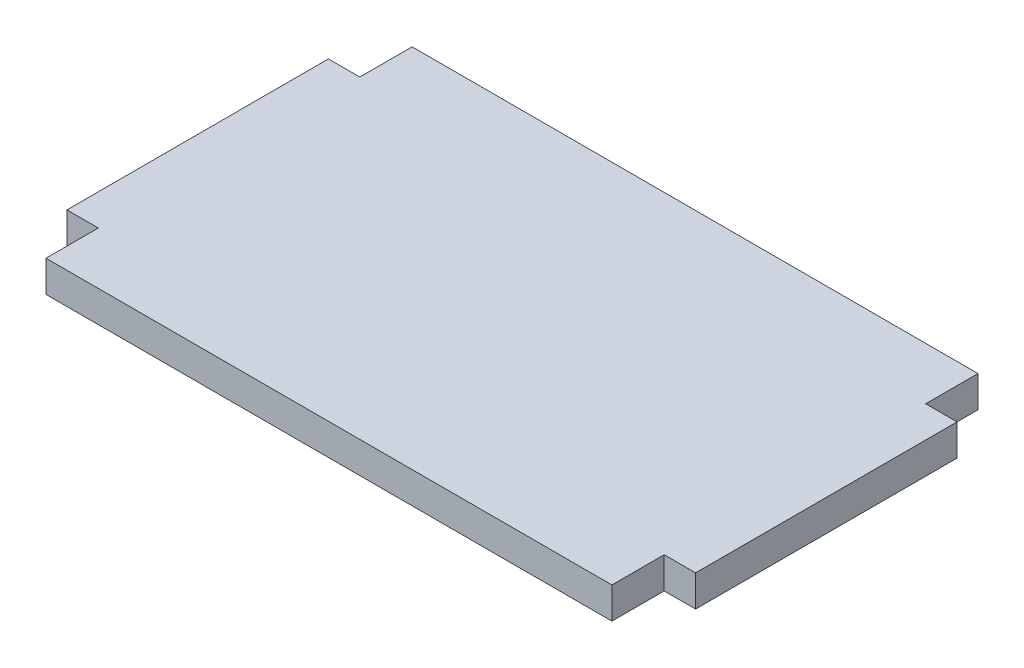
from build123d import *

# Parameters (mm, degrees)
SKETCH1_W           = 108.2
SKETCH1_H           = 50
BOSS_EXTRUDE1_DEPTH = 6
SKETCH2_W           = 50
SKETCH2_H           = 6
BOSS_EXTRUDE2_DEPTH = 6
SKETCH3_W           = 50
SKETCH3_H           = 6
BOSS_EXTRUDE3_DEPTH = 6
SKETCH4_W           = 108.2
SKETCH4_H           = 6
BOSS_EXTRUDE4_DEPTH = 10
SKETCH5_W           = 108.2
SKETCH5_H           = 6
BOSS_EXTRUDE5_DEPTH = 10


with BuildPart() as part:
    # Sketch1 → Boss-Extrude1 (new body)
    with BuildSketch(Plane(origin=(0, 0, 0), x_dir=(1, 0, 0), z_dir=(0, 1, 0))):
        with Locations((54.1, 25)):
            Rectangle(SKETCH1_W, SKETCH1_H)
    extrude(amount=BOSS_EXTRUDE1_DEPTH)

    # Sketch2 → Boss-Extrude2 (add)
    with BuildSketch(Plane.ZY):
        with Locations((-25, 3)):
            Rectangle(SKETCH2_W, SKETCH2_H)
    extrude(amount=BOSS_EXTRUDE2_DEPTH)

    # Sketch3 → Boss-Extrude3 (add)
    with BuildSketch(Plane(origin=(108.2, 0, 0), x_dir=(0, 0, -1), z_dir=(1, 0, 0))):
        with Locations((25, 3)):
            Rectangle(SKETCH3_W, SKETCH3_H)
    extrude(amount=BOSS_EXTRUDE3_DEPTH)

    # Sketch4 → Boss-Extrude4 (add)
    with BuildSketch(Plane(origin=(0, 0, -50), x_dir=(-1, 0, 0), z_dir=(0, 0, -1))):
        with Locations((-54.1, 3)):
            Rectangle(SKETCH4_W, SKETCH4_H)
    extrude(amount=BOSS_EXTRUDE4_DEPTH)

    # Sketch5 → Boss-Extrude5 (add)
    with BuildSketch(Plane.XY):
        with Locations((54.1, 3)):
            Rectangle(SKETCH5_W, SKETCH5_H)
    extrude(amount=BOSS_EXTRUDE5_DEPTH)


solid = part.part
